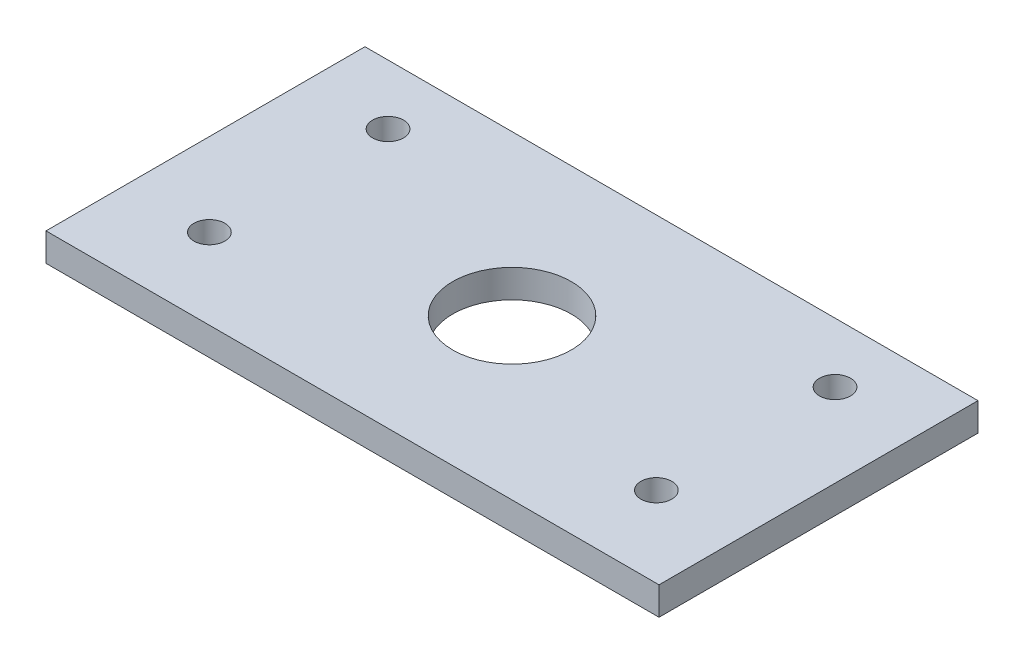
from build123d import *

# Parameters (mm, degrees)
SKETCH5_W           = 108.936727432
SKETCH5_H           = 56.682524842
BOSS_EXTRUDE2_DEPTH = 5
SKETCH7_R           = 2.75
CUT_EXTRUDE3_DEPTH  = 5
SKETCH8_R           = 10.536528042
CUT_EXTRUDE4_DEPTH  = 5


with BuildPart() as part:
    # Sketch5 → Boss-Extrude2 (new body)
    with BuildSketch(Plane(origin=(0, 12.8, 0), x_dir=(1, 0, 0), z_dir=(0, 1, 0))):
        Rectangle(SKETCH5_W, SKETCH5_H)
    extrude(amount=BOSS_EXTRUDE2_DEPTH)

    # Sketch7 → Cut-Extrude3 (cut)
    with BuildSketch(Plane(origin=(0, 17.8, 0), x_dir=(1, 0, 0), z_dir=(0, 1, 0))):
        with Locations(Location((-39.751045376, 17.724843824, 0), (0, 0, 270))):
            Circle(SKETCH7_R)
        with Locations(Location((-39.751045376, -14.025156176, 0), (0, 0, 270))):
            Circle(SKETCH7_R)
        with Locations(Location((39.675944836, -14.025156176, 0), (0, 0, 270))):
            Circle(SKETCH7_R)
        with Locations(Location((39.675944836, 17.724843824, 0), (0, 0, 270))):
            Circle(SKETCH7_R)
    extrude(amount=-CUT_EXTRUDE3_DEPTH, mode=Mode.SUBTRACT)

    # Sketch8 → Cut-Extrude4 (cut)
    with BuildSketch(Plane(origin=(0, 17.8, 0), x_dir=(1, 0, 0), z_dir=(0, 1, 0))):
        with Locations(Location((0, 0, 0), (0, 0, 270))):
            Circle(SKETCH8_R)
    extrude(amount=-CUT_EXTRUDE4_DEPTH, mode=Mode.SUBTRACT)


solid = part.part
